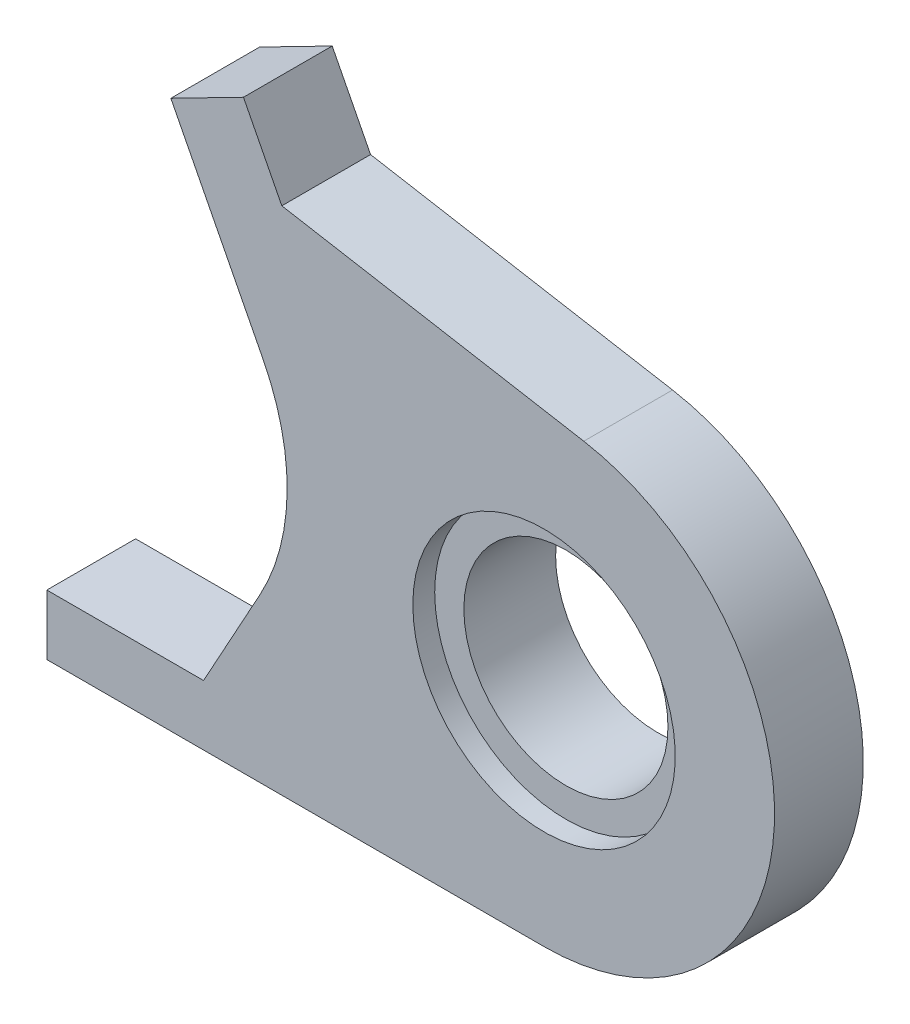
from build123d import *

# Parameters (mm, degrees)
SKETCH2_R           = 90
BOSS_EXTRUDE1_DEPTH = 60.865268403


with BuildPart() as part:
    # Sketch1 → Revolve1 (revolve)
    with BuildSketch(Plane(origin=(0, 0, 0), x_dir=(1, 0, 0), z_dir=(0, 1, 0))):
        Polygon((-90, -29.79575879), (-90, -14.79575879), (-70, -14.79575879), (-70, 48.140410311), (-99.097023169, 48.140410311), (-99.097023169, 31.069509613), (-158.113565582, 31.069509613), (-158.113565582, -29.79575879), align=None)
    revolve(axis=Axis((0, 0, 0), (0, 0, 1)))

    # Sketch2 → Boss-Extrude1 (add)
    with BuildSketch(Plane(origin=(0, 0, -31.069509613), x_dir=(-1, 0, 0), z_dir=(0, 0, -1))):
        with BuildLine():
            Line((0, -158.113565582), (341.027566012, -158.113565582))
            Line((341.027566012, -158.113565582), (341.027566012, -116.806868092))
            Line((341.027566012, -116.806868092), (233.535117418, -116.806868092))
            Line((233.535117418, -116.806868092), (194.760807878, -46.320749515))
            ThreePointArc((194.760807878, -46.320749515), (176.203837582, 23.778561234), (192.69826547, 94.391650408))
            Line((192.69826547, 94.391650408), (255.959925105, 217.8266932))
            Line((255.959925105, 217.8266932), (206.159608852, 243.349839506))
            Line((206.159608852, 243.349839506), (179.847269567, 192.009663729))
            Line((179.847269567, 192.009663729), (-27.270239804, 155.744128756))
            ThreePointArc((-27.270239804, 155.744128756), (-157.520092587, -13.686491605), (0, -158.113565582))
        make_face()
        Circle(SKETCH2_R, mode=Mode.SUBTRACT)
    extrude(amount=-BOSS_EXTRUDE1_DEPTH)


solid = part.part
